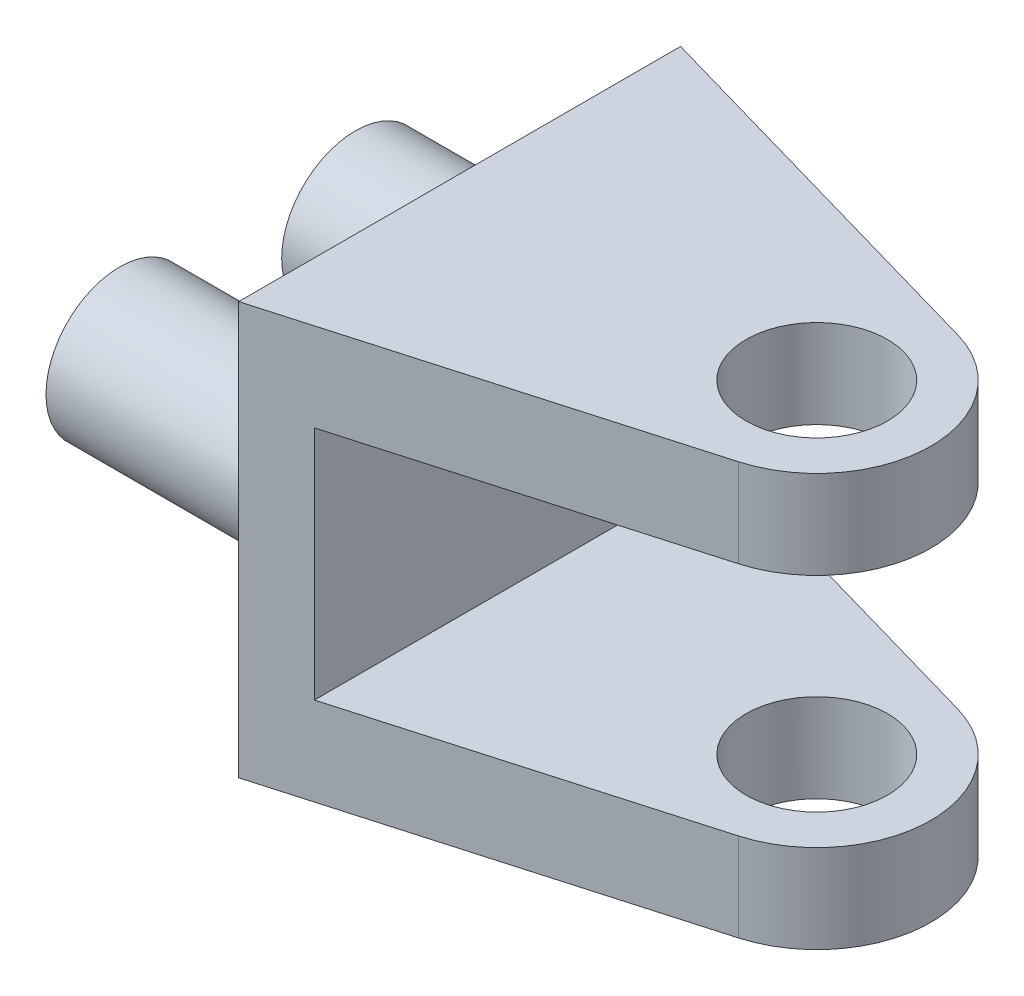
from build123d import *

# Parameters (mm, degrees)
SKETCH1_R           = 2.4
BOSS_EXTRUDE1_DEPTH = 14
SKETCH3_W           = 16.77722104
SKETCH3_H           = 8
CUT_EXTRUDE2_DEPTH  = 26
SKETCH4_R           = 2.5
SKETCH4_R_2         = 1.5
BOSS_EXTRUDE2_DEPTH = 7.54


with BuildPart() as part:
    # Sketch1 → Boss-Extrude1 (new body)
    with BuildSketch(Plane(origin=(0, 0, 0), x_dir=(1, 0, 0), z_dir=(0, 1, 0))):
        with BuildLine():
            Line((-12.125, 7.5), (-12.125, -7.5))
            Line((-12.125, -7.5), (1.066020546, -3.725483216))
            ThreePointArc((1.066020546, -3.725483216), (3.875, 0), (1.066020546, 3.725483216))
            Line((1.066020546, 3.725483216), (-12.125, 7.5))
        make_face()
        with Locations(Location((0, 0, 0), (0, 0, 270))):
            Circle(SKETCH1_R, mode=Mode.SUBTRACT)
    extrude(amount=BOSS_EXTRUDE1_DEPTH)

    # Sketch3 → Cut-Extrude2 (cut, symmetric)
    with BuildSketch(Plane.XY):
        with Locations((-1.73638948, 7)):
            Rectangle(SKETCH3_W, SKETCH3_H)
    extrude(amount=CUT_EXTRUDE2_DEPTH, both=True, mode=Mode.SUBTRACT)

    # Sketch4 → Boss-Extrude2 (add)
    # profile 1 of 2: a face of its own
    with BuildSketch(Plane.ZY.offset(12.125)):
        with Locations(Location((4, 7, 0), (0, 0, 180))):
            Circle(SKETCH4_R)
        with Locations((4, 7)):
            Circle(SKETCH4_R_2, mode=Mode.SUBTRACT)
    # profile 2 of 2: a face of its own
    with BuildSketch(Plane.ZY.offset(12.125)):
        with Locations(Location((-4, 7, 0), (0, 0, 180))):
            Circle(SKETCH4_R)
        with Locations((-4, 7)):
            Circle(SKETCH4_R_2, mode=Mode.SUBTRACT)
    extrude(amount=BOSS_EXTRUDE2_DEPTH)


solid = part.part
